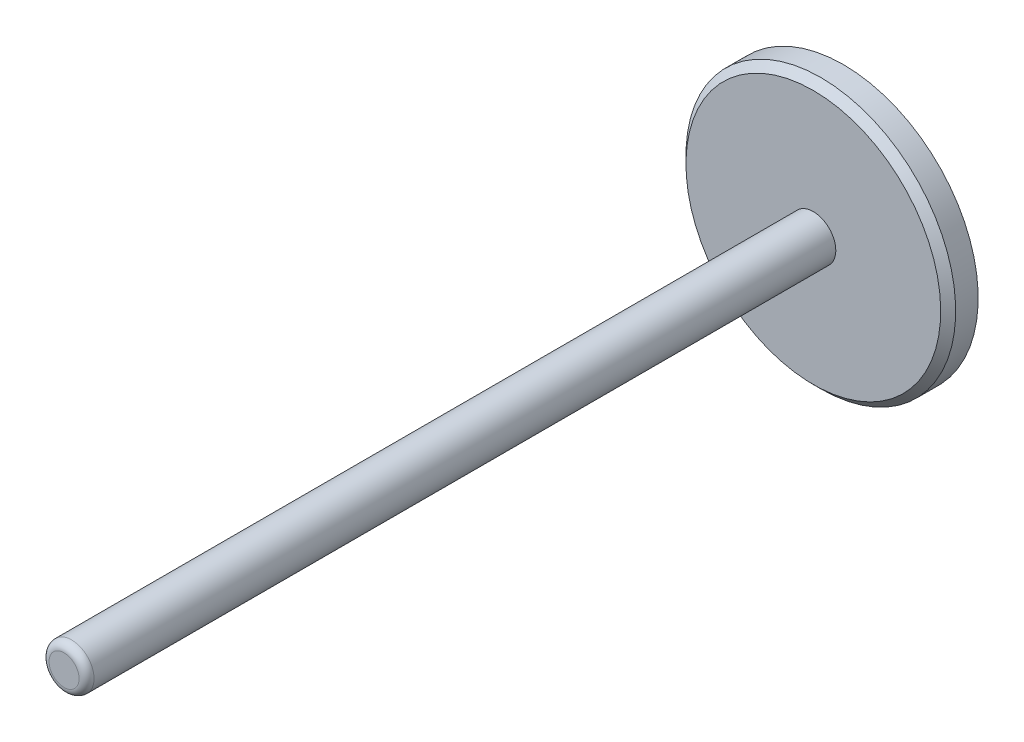
from build123d import *

# Parameters (mm, degrees)
FILLET1_R     = 0.5
CHAMFER1_SIZE = 0.5


with BuildPart() as part:
    # Sketch1 → Revolve1 (revolve)
    with BuildSketch(Plane.YZ):
        Polygon((0, 50), (0, -2), (9, -2), (9, 0), (1.5, 0), (1.5, 50), align=None)
    revolve(axis=Axis((0, 0, -11.370061245), (0, 0, 1)))

    # Fillet1
    fillet1_edges = [part.edges().sort_by_distance(p)[0] for p in [
        (0, -1.5, 50),
    ]]
    fillet(fillet1_edges, radius=FILLET1_R)

    # Chamfer1
    chamfer1_edges = [part.edges().sort_by_distance(p)[0] for p in [
        (0, -9, 0),
    ]]
    chamfer(chamfer1_edges, length=CHAMFER1_SIZE)


solid = part.part
